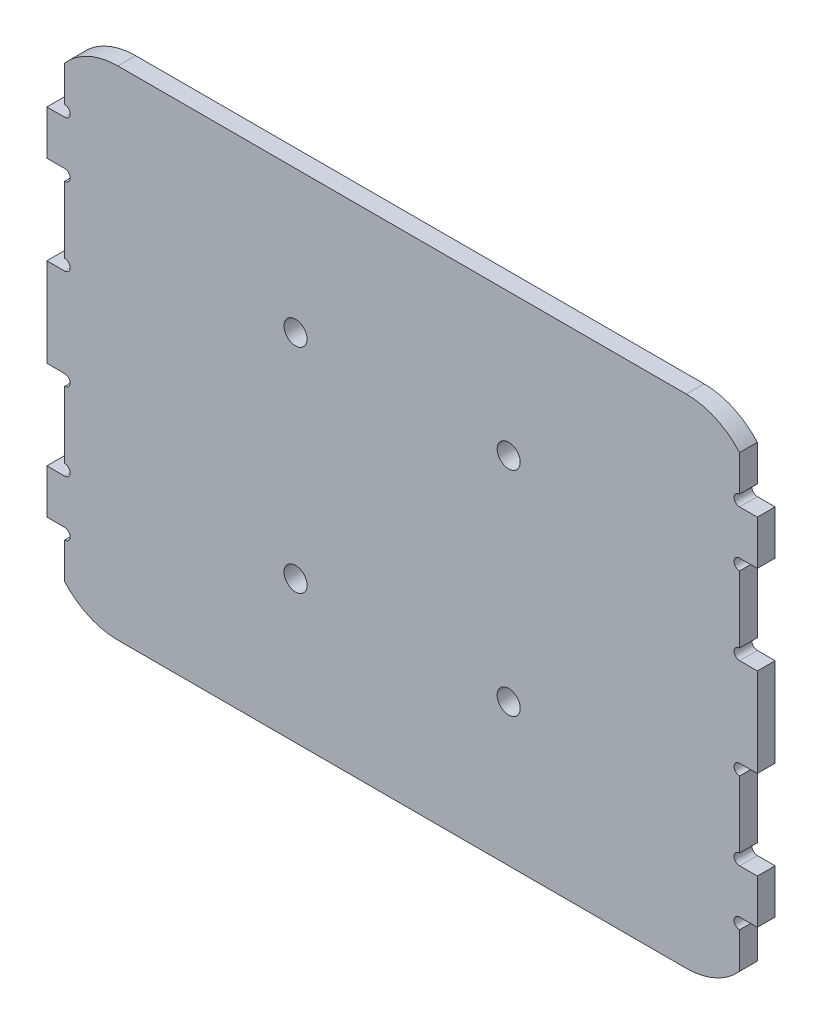
from build123d import *

# Parameters (mm, degrees)
SKETCH_1_W          = 200
SKETCH_1_H          = 140
SKETCH_1_R          = 3.25
EXTRUDE_1_DEPTH     = 5
FILLET_1_R          = 20
SKETCH_3_W          = 5
SKETCH_3_H          = 25
SKETCH_3_H_2        = 22.807543944
CUT_EXTRUDE_1_DEPTH = 39
SKETCH_4_R          = 1.55
CUT_EXTRUDE_2_DEPTH = 10


with BuildPart() as part:
    # 草图1 → 凸台-拉伸1 (new body)
    with BuildSketch(Plane.XY):
        with Locations((0, 50)):
            Rectangle(SKETCH_1_W, SKETCH_1_H)
        with Locations((30, 80)):
            Circle(SKETCH_1_R, mode=Mode.SUBTRACT)
        with Locations(Location((30, 20, 0), (0, 0, 180))):
            Circle(SKETCH_1_R, mode=Mode.SUBTRACT)
        with Locations(Location((-30, 80, 0), (0, 0, 180))):
            Circle(SKETCH_1_R, mode=Mode.SUBTRACT)
        with Locations((-30, 20)):
            Circle(SKETCH_1_R, mode=Mode.SUBTRACT)
    extrude(amount=EXTRUDE_1_DEPTH)

    # 圆角1
    fillet_1_edges = [part.edges().sort_by_distance(p)[0] for p in [
        (-100, 120, 2.5),
        (-100, -20, 2.5),
        (100, -20, 2.5),
        (100, 120, 2.5),
    ]]
    fillet(fillet_1_edges, radius=FILLET_1_R)

    # 草图3 → 切除-拉伸1 (cut)
    with BuildSketch(Plane.XY.offset(5)):
        with Locations((97.5, 75)):
            Rectangle(SKETCH_3_W, SKETCH_3_H)
        with Locations((97.5, 25)):
            Rectangle(SKETCH_3_W, SKETCH_3_H)
        with Locations((-97.5, 25)):
            Rectangle(SKETCH_3_W, SKETCH_3_H)
        with Locations((-97.5, 75)):
            Rectangle(SKETCH_3_W, SKETCH_3_H)
        with Locations((-97.5, -11.403771972)):
            Rectangle(SKETCH_3_W, SKETCH_3_H_2)
        with Locations((97.5, -11.403771972)):
            Rectangle(SKETCH_3_W, SKETCH_3_H_2)
        with Locations((-97.5, 111.403771972)):
            Rectangle(SKETCH_3_W, SKETCH_3_H_2)
        with Locations((97.5, 111.403771972)):
            Rectangle(SKETCH_3_W, SKETCH_3_H_2)
    extrude(amount=-CUT_EXTRUDE_1_DEPTH, mode=Mode.SUBTRACT)

    # 草图4 → 切除-拉伸2 (cut)
    with BuildSketch(Plane.XY.offset(5)):
        with Locations((95, 85.95)):
            Circle(SKETCH_4_R)
        with Locations((95, 64.05)):
            Circle(SKETCH_4_R)
        with Locations((95, 35.95)):
            Circle(SKETCH_4_R)
        with Locations((95, 14.05)):
            Circle(SKETCH_4_R)
        with Locations((-95, 14.05)):
            Circle(SKETCH_4_R)
        with Locations((-95, 35.95)):
            Circle(SKETCH_4_R)
        with Locations((-95, 64.05)):
            Circle(SKETCH_4_R)
        with Locations((-95, 85.95)):
            Circle(SKETCH_4_R)
        with Locations((95, -1.55)):
            Circle(SKETCH_4_R)
        with Locations((-95, -1.55)):
            Circle(SKETCH_4_R)
        with Locations((95, 101.55)):
            Circle(SKETCH_4_R)
        with Locations((-95, 101.55)):
            Circle(SKETCH_4_R)
    extrude(amount=-CUT_EXTRUDE_2_DEPTH, mode=Mode.SUBTRACT)


solid = part.part
